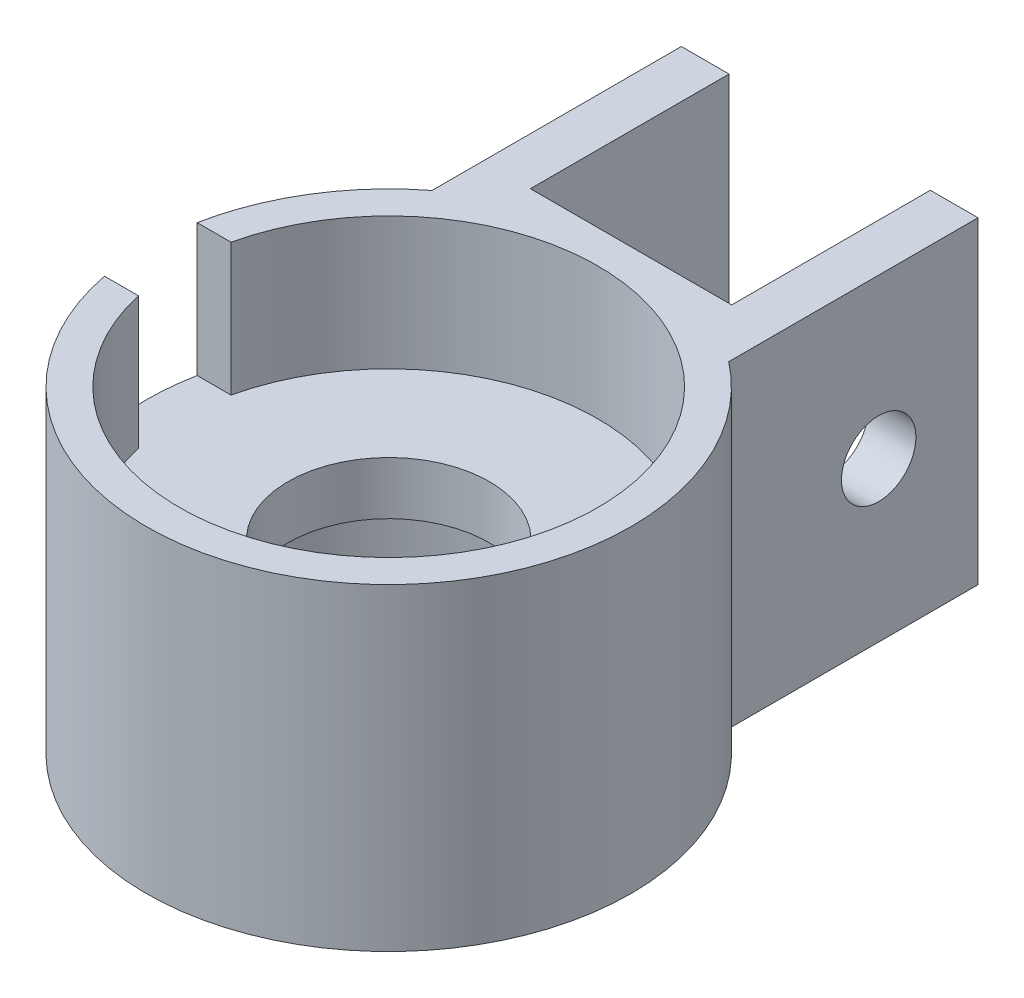
from build123d import *
from build123d.topology import SkipClean

# Parameters (mm, degrees)
SKETCH1_R                = 23.241
SKETCH1_R_2              = 9.652
BOSS_EXTRUDE1_DEPTH      = 5.08
BOSS_EXTRUDE2_DEPTH      = 12.7
BOSS_EXTRUDE2_DEPTH_BACK = 17.78
F_1_4_CLEARANCE_HOLE1_D  = 7.14248


with BuildPart() as part:
    # Sketch1 → Boss-Extrude1 (new body)
    with BuildSketch(Plane(origin=(0, 0, 0), x_dir=(1, 0, 0), z_dir=(0, 1, 0))):
        with Locations(Location((0, 0, 0), (0, 0, 270))):
            Circle(SKETCH1_R)
        with Locations(Location((0, 0, 0), (0, 0, 270))):
            Circle(SKETCH1_R_2, mode=Mode.SUBTRACT)
    extrude(amount=BOSS_EXTRUDE1_DEPTH)

    # Sketch2 → Boss-Extrude2 (add, two sides: drawn at the far end of the back side and taken through both)
    with SkipClean():  # the faces are left unmerged after this step: merging them gives an invalid solid
        with BuildSketch(Plane(origin=(0, 5.08, 0), x_dir=(1, 0, 0), z_dir=(0, 1, 0)).offset(-BOSS_EXTRUDE2_DEPTH_BACK)):
            with BuildLine():
                Line((-14.224, 18.379932), (-14.224, 42.291))
                Line((-14.224, 42.291), (-9.652, 42.291))
                Line((-9.652, 42.291), (-9.652, 23.241))
                Line((-9.652, 23.241), (9.652, 23.241))
                Line((9.652, 23.241), (9.652, 42.291))
                Line((9.652, 42.291), (14.224, 42.291))
                Line((14.224, 42.291), (14.224, 18.379932))
                ThreePointArc((14.224, 18.379932), (12.193551, -19.785383), (-22.811972, -4.445))
                Line((-22.811972, -4.445), (-19.567481, -4.445))
                ThreePointArc((-19.567481, -4.445), (20.066, 0), (-19.567481, 4.445))
                Line((-19.567481, 4.445), (-22.811972, 4.445))
                ThreePointArc((-22.811972, 4.445), (-19.785383, 12.193551), (-14.224, 18.379932))
            make_face()
        extrude(amount=BOSS_EXTRUDE2_DEPTH + BOSS_EXTRUDE2_DEPTH_BACK)

    # 1/4 Clearance Hole1 (through all)
    with Locations(Plane(origin=(14.224, 0, 0), x_dir=(0, 0, -1), z_dir=(1, 0, 0))):
        with Locations((32.766, 2.54)):
            Hole(F_1_4_CLEARANCE_HOLE1_D / 2)


solid = part.part
